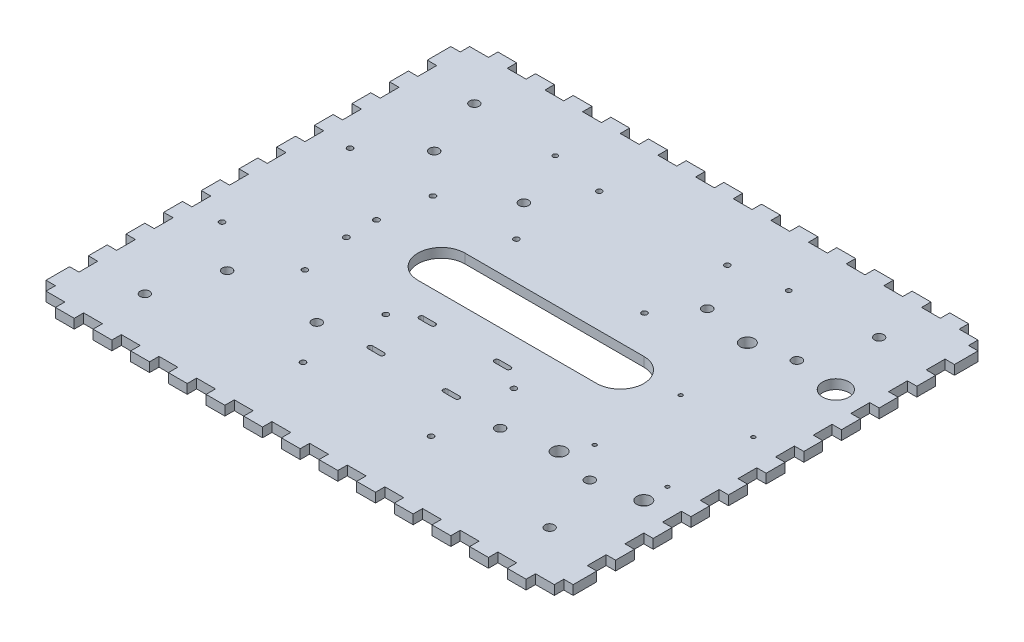
from build123d import *

# Parameters (mm, degrees)
SKETCH1_W               = 355.6
SKETCH1_H               = 298.45
SKETCH1_R               = 1.905
BOSS_EXTRUDE1_DEPTH     = 6.35
SKETCH2_R               = 3.2385
CUT_EXTRUDE1_DEPTH      = 233.209524191
CUT_EXTRUDE3_DEPTH      = 233.209524191
CUT_EXTRUDE4_DEPTH      = 233.209524191
SKETCH8_R               = 4.7625
CUT_EXTRUDE5_DEPTH      = 233.209524191
LPATTERN1_COUNT         = 2
LPATTERN1_PITCH         = 57.15
SKETCH9_R               = 1.27
CUT_EXTRUDE6_DEPTH      = 233.209524191
SKETCH10_R              = 1.8415
CUT_EXTRUDE7_DEPTH      = 233.209524191
SKETCH11_R              = 1.84658
CUT_EXTRUDE8_DEPTH      = 233.209524191
SKETCH13_R              = 8.89
CUT_EXTRUDE9_DEPTH      = 233.209524191
SKETCH16_W              = 25.4
SKETCH16_H              = 12.7
CUT_EXTRUDE19_DEPTH     = 233.209524191
LPATTERN2_COUNT         = 10
LPATTERN2_PITCH         = 25.4
MIRROR4_COPY_1_SKETCH_W = 25.4
MIRROR4_COPY_1_SKETCH_H = 12.7
MIRROR4_COPY_1_DEPTH    = 233.209524191
MIRROR4_COPY_2_SKETCH_W = 25.4
MIRROR4_COPY_2_SKETCH_H = 12.7
MIRROR4_COPY_2_DEPTH    = 233.209524191
MIRROR4_COPY_3_SKETCH_W = 25.4
MIRROR4_COPY_3_SKETCH_H = 12.7
MIRROR4_COPY_3_DEPTH    = 233.209524191
MIRROR4_COPY_4_SKETCH_W = 25.4
MIRROR4_COPY_4_SKETCH_H = 12.7
MIRROR4_COPY_4_DEPTH    = 233.209524191
MIRROR4_COPY_5_SKETCH_W = 25.4
MIRROR4_COPY_5_SKETCH_H = 12.7
MIRROR4_COPY_5_DEPTH    = 233.209524191
MIRROR4_COPY_6_SKETCH_W = 25.4
MIRROR4_COPY_6_SKETCH_H = 12.7
MIRROR4_COPY_6_DEPTH    = 233.209524191
MIRROR4_COPY_7_SKETCH_W = 25.4
MIRROR4_COPY_7_SKETCH_H = 12.7
MIRROR4_COPY_7_DEPTH    = 233.209524191
MIRROR4_COPY_8_SKETCH_W = 25.4
MIRROR4_COPY_8_SKETCH_H = 12.7
MIRROR4_COPY_8_DEPTH    = 233.209524191
MIRROR4_COPY_9_SKETCH_W = 25.4
MIRROR4_COPY_9_SKETCH_H = 12.7
MIRROR4_COPY_9_DEPTH    = 233.209524191
SKETCH17_R              = 3.175
CUT_EXTRUDE20_DEPTH     = 233.209524191
SKETCH18_W              = 25.4
SKETCH18_H              = 25.4
CUT_EXTRUDE21_DEPTH     = 233.209524191
SKETCH15_W              = 12.7
SKETCH15_H              = 25.4
SKETCH15_W_2            = 25.4
CUT_EXTRUDE22_DEPTH     = 233.209524191
SKETCH19_R              = 1.6002
CUT_EXTRUDE23_DEPTH     = 233.209524191


with BuildPart() as part:
    # Sketch1 → Boss-Extrude1 (new body)
    with BuildSketch(Plane(origin=(0, 0, 0), x_dir=(1, 0, 0), z_dir=(0, 1, 0))):
        Rectangle(SKETCH1_W, SKETCH1_H)
        with Locations(Location((-101.6, 10.16, 0), (0, 0, 270))):
            Circle(SKETCH1_R, mode=Mode.SUBTRACT)
        with Locations(Location((-101.6, -10.16, 0), (0, 0, 270))):
            Circle(SKETCH1_R, mode=Mode.SUBTRACT)
    extrude(amount=BOSS_EXTRUDE1_DEPTH)

    # Sketch2 → Cut-Extrude1 (cut, through all)
    with BuildSketch(Plane(origin=(0, 6.35, 0), x_dir=(1, 0, 0), z_dir=(0, 1, 0))):
        with Locations(Location((61.838205, -69.85, 0), (0, 0, 90))):
            Circle(SKETCH2_R)
        with Locations(Location((122.311795, -69.85, 0), (0, 0, 90))):
            Circle(SKETCH2_R)
        with Locations(Location((-122.311795, -69.85, 0), (0, 0, 90))):
            Circle(SKETCH2_R)
        with Locations(Location((-61.838205, -69.85, 0), (0, 0, 90))):
            Circle(SKETCH2_R)
        with Locations(Location((-122.311795, 69.85, 0), (0, 0, 90))):
            Circle(SKETCH2_R)
        with Locations(Location((-61.838205, 69.85, 0), (0, 0, 90))):
            Circle(SKETCH2_R)
        with Locations(Location((61.838205, 69.85, 0), (0, 0, 90))):
            Circle(SKETCH2_R)
        with Locations(Location((122.311795, 69.85, 0), (0, 0, 90))):
            Circle(SKETCH2_R)
    extrude(amount=-CUT_EXTRUDE1_DEPTH, mode=Mode.SUBTRACT)

    # Sketch5 → Cut-Extrude3 (cut, through all)
    with BuildSketch(Plane(origin=(0, 6.35, 0), x_dir=(-1, 0, 0), z_dir=(0, 1, 0))):
        with BuildLine():
            Line((-68.2625, 11.1125), (52.3875, 11.1125))
            ThreePointArc((52.3875, 11.1125), (68.2625, -4.7625), (52.3875, -20.6375))
            Line((52.3875, -20.6375), (-68.2625, -20.6375))
            ThreePointArc((-68.2625, -20.6375), (-84.1375, -4.7625), (-68.2625, 11.1125))
        make_face()
    extrude(amount=-CUT_EXTRUDE3_DEPTH, mode=Mode.SUBTRACT)

    # Sketch7 → Cut-Extrude4 (cut, through all)
    with BuildSketch(Plane(origin=(0, 6.35, 0), x_dir=(1, 0, 0), z_dir=(0, 1, 0))):
        with BuildLine():
            Line((21.43125, -30.1625), (29.36875, -30.1625))
            ThreePointArc((29.36875, -30.1625), (30.95625, -31.75), (29.36875, -33.3375))
            Line((29.36875, -33.3375), (21.43125, -33.3375))
            ThreePointArc((21.43125, -33.3375), (19.84375, -31.75), (21.43125, -30.1625))
        make_face()
        with BuildLine():
            Line((-21.43125, -30.1625), (-29.36875, -30.1625))
            ThreePointArc((-29.36875, -30.1625), (-30.95625, -31.75), (-29.36875, -33.3375))
            Line((-29.36875, -33.3375), (-21.43125, -33.3375))
            ThreePointArc((-21.43125, -33.3375), (-19.84375, -31.75), (-21.43125, -30.1625))
        make_face()
        with BuildLine():
            Line((21.43125, -67.8815), (29.36875, -67.8815))
            ThreePointArc((29.36875, -67.8815), (30.95625, -66.294), (29.36875, -64.7065))
            Line((29.36875, -64.7065), (21.43125, -64.7065))
            ThreePointArc((21.43125, -64.7065), (19.84375, -66.294), (21.43125, -67.8815))
        make_face()
        with BuildLine():
            Line((-21.43125, -67.8815), (-29.36875, -67.8815))
            ThreePointArc((-29.36875, -67.8815), (-30.95625, -66.294), (-29.36875, -64.7065))
            Line((-29.36875, -64.7065), (-21.43125, -64.7065))
            ThreePointArc((-21.43125, -64.7065), (-19.84375, -66.294), (-21.43125, -67.8815))
        make_face()
    extrude(amount=-CUT_EXTRUDE4_DEPTH, mode=Mode.SUBTRACT)

    # Sketch8 → Cut-Extrude5 (cut, through all)
    with BuildSketch(Plane(origin=(0, 6.35, 0), x_dir=(1, 0, 0), z_dir=(0, 1, 0))):
        with Locations(Location((152.4, 63.5, 0), (0, 0, 270))):
            Circle(SKETCH8_R)
        with Locations(Location((152.4, -63.5, 0), (0, 0, 90))):
            Circle(SKETCH8_R)
    cut_extrude5 = extrude(amount=-CUT_EXTRUDE5_DEPTH, mode=Mode.SUBTRACT)

    # LPattern1: Cut-Extrude5 ×2
    with Locations(*[(-i * LPATTERN1_PITCH, 0, 0) for i in range(1, LPATTERN1_COUNT)]):
        add(cut_extrude5, mode=Mode.SUBTRACT)

    # Sketch9 → Cut-Extrude6 (cut, through all)
    with BuildSketch(Plane(origin=(0, 6.35, 0), x_dir=(1, 0, 0), z_dir=(0, 1, 0))):
        with Locations(Location((103.400098, 10.374884, 0), (0, 0, 270))):
            Circle(SKETCH9_R)
        with Locations(Location((152.4, 10.374884, 0), (0, 0, 270))):
            Circle(SKETCH9_R)
        with Locations(Location((103.400098, -47.625, 0), (0, 0, 270))):
            Circle(SKETCH9_R)
        with Locations(Location((152.4, -47.625, 0), (0, 0, 270))):
            Circle(SKETCH9_R)
    extrude(amount=-CUT_EXTRUDE6_DEPTH, mode=Mode.SUBTRACT)

    # Sketch10 → Cut-Extrude7 (cut, through all)
    with BuildSketch(Plane(origin=(0, 6.35, 0), x_dir=(1, 0, 0), z_dir=(0, 1, 0))):
        with Locations(Location((-43.18, -41.91, 0), (0, 0, 270))):
            Circle(SKETCH10_R)
        with Locations(Location((43.18, -41.91, 0), (0, 0, 90))):
            Circle(SKETCH10_R)
        with Locations(Location((43.18, -97.79, 0), (0, 0, 270))):
            Circle(SKETCH10_R)
        with Locations(Location((-43.18, -97.79, 0), (0, 0, 90))):
            Circle(SKETCH10_R)
    cut_extrude7 = extrude(amount=-CUT_EXTRUDE7_DEPTH, mode=Mode.SUBTRACT)

    # Mirror2: Cut-Extrude7 across plane
    add(cut_extrude7.mirror(Plane.XY.offset(-2.116666582)), mode=Mode.SUBTRACT)

    # Sketch11 → Cut-Extrude8 (cut, through all)
    with BuildSketch(Plane(origin=(0, 6.35, 0), x_dir=(1, 0, 0), z_dir=(0, 1, 0))):
        with Locations(Location((-152.4, 43.18, 0), (0, 0, 270))):
            Circle(SKETCH11_R)
        with Locations(Location((-96.52, 43.18, 0), (0, 0, 90))):
            Circle(SKETCH11_R)
        with Locations(Location((-96.52, -43.18, 0), (0, 0, 270))):
            Circle(SKETCH11_R)
        with Locations(Location((-152.4, -43.18, 0), (0, 0, 90))):
            Circle(SKETCH11_R)
    extrude(amount=-CUT_EXTRUDE8_DEPTH, mode=Mode.SUBTRACT)

    # Sketch13 → Cut-Extrude9 (cut, through all)
    with BuildSketch(Plane(origin=(0, 6.35, 0), x_dir=(1, 0, 0), z_dir=(0, 1, 0))):
        with Locations(Location((152.4, 66.04, 0), (0, 0, 270))):
            Circle(SKETCH13_R)
    extrude(amount=-CUT_EXTRUDE9_DEPTH, mode=Mode.SUBTRACT)

    # Sketch16 → Cut-Extrude19 (cut, symmetric)
    with BuildSketch(Plane(origin=(0, 6.35, 0), x_dir=(1, 0, 0), z_dir=(0, 1, 0))):
        with Locations((184.15, 114.3)):
            Rectangle(SKETCH16_W, SKETCH16_H)
    cut_extrude19 = extrude(amount=CUT_EXTRUDE19_DEPTH, both=True, mode=Mode.SUBTRACT)

    # LPattern2: Cut-Extrude19 ×10
    with Locations(*[(0, 0, i * LPATTERN2_PITCH) for i in range(1, LPATTERN2_COUNT)]):
        add(cut_extrude19, mode=Mode.SUBTRACT)

    # Mirror4: Cut-Extrude19 across plane
    add(cut_extrude19.mirror(Plane(origin=(0, 0, 0), x_dir=(0, 0, 1), z_dir=(1, 0, 0))), mode=Mode.SUBTRACT)

    # Mirror4 copy 1 sketch → Mirror4 copy 1 (cut, symmetric)
    with BuildSketch(Plane(origin=(0, 6.35, 25.4), x_dir=(-1, 0, 0), z_dir=(0, 1, 0))):
        with Locations((184.15, -114.3)):
            Rectangle(MIRROR4_COPY_1_SKETCH_W, MIRROR4_COPY_1_SKETCH_H)
    extrude(amount=MIRROR4_COPY_1_DEPTH, both=True, mode=Mode.SUBTRACT)

    # Mirror4 copy 2 sketch → Mirror4 copy 2 (cut, symmetric)
    with BuildSketch(Plane(origin=(0, 6.35, 50.8), x_dir=(-1, 0, 0), z_dir=(0, 1, 0))):
        with Locations((184.15, -114.3)):
            Rectangle(MIRROR4_COPY_2_SKETCH_W, MIRROR4_COPY_2_SKETCH_H)
    extrude(amount=MIRROR4_COPY_2_DEPTH, both=True, mode=Mode.SUBTRACT)

    # Mirror4 copy 3 sketch → Mirror4 copy 3 (cut, symmetric)
    with BuildSketch(Plane(origin=(0, 6.35, 76.2), x_dir=(-1, 0, 0), z_dir=(0, 1, 0))):
        with Locations((184.15, -114.3)):
            Rectangle(MIRROR4_COPY_3_SKETCH_W, MIRROR4_COPY_3_SKETCH_H)
    extrude(amount=MIRROR4_COPY_3_DEPTH, both=True, mode=Mode.SUBTRACT)

    # Mirror4 copy 4 sketch → Mirror4 copy 4 (cut, symmetric)
    with BuildSketch(Plane(origin=(0, 6.35, 101.6), x_dir=(-1, 0, 0), z_dir=(0, 1, 0))):
        with Locations((184.15, -114.3)):
            Rectangle(MIRROR4_COPY_4_SKETCH_W, MIRROR4_COPY_4_SKETCH_H)
    extrude(amount=MIRROR4_COPY_4_DEPTH, both=True, mode=Mode.SUBTRACT)

    # Mirror4 copy 5 sketch → Mirror4 copy 5 (cut, symmetric)
    with BuildSketch(Plane(origin=(0, 6.35, 127), x_dir=(-1, 0, 0), z_dir=(0, 1, 0))):
        with Locations((184.15, -114.3)):
            Rectangle(MIRROR4_COPY_5_SKETCH_W, MIRROR4_COPY_5_SKETCH_H)
    extrude(amount=MIRROR4_COPY_5_DEPTH, both=True, mode=Mode.SUBTRACT)

    # Mirror4 copy 6 sketch → Mirror4 copy 6 (cut, symmetric)
    with BuildSketch(Plane(origin=(0, 6.35, 152.4), x_dir=(-1, 0, 0), z_dir=(0, 1, 0))):
        with Locations((184.15, -114.3)):
            Rectangle(MIRROR4_COPY_6_SKETCH_W, MIRROR4_COPY_6_SKETCH_H)
    extrude(amount=MIRROR4_COPY_6_DEPTH, both=True, mode=Mode.SUBTRACT)

    # Mirror4 copy 7 sketch → Mirror4 copy 7 (cut, symmetric)
    with BuildSketch(Plane(origin=(0, 6.35, 177.8), x_dir=(-1, 0, 0), z_dir=(0, 1, 0))):
        with Locations((184.15, -114.3)):
            Rectangle(MIRROR4_COPY_7_SKETCH_W, MIRROR4_COPY_7_SKETCH_H)
    extrude(amount=MIRROR4_COPY_7_DEPTH, both=True, mode=Mode.SUBTRACT)

    # Mirror4 copy 8 sketch → Mirror4 copy 8 (cut, symmetric)
    with BuildSketch(Plane(origin=(0, 6.35, 203.2), x_dir=(-1, 0, 0), z_dir=(0, 1, 0))):
        with Locations((184.15, -114.3)):
            Rectangle(MIRROR4_COPY_8_SKETCH_W, MIRROR4_COPY_8_SKETCH_H)
    extrude(amount=MIRROR4_COPY_8_DEPTH, both=True, mode=Mode.SUBTRACT)

    # Mirror4 copy 9 sketch → Mirror4 copy 9 (cut, symmetric)
    with BuildSketch(Plane(origin=(0, 6.35, 228.6), x_dir=(-1, 0, 0), z_dir=(0, 1, 0))):
        with Locations((184.15, -114.3)):
            Rectangle(MIRROR4_COPY_9_SKETCH_W, MIRROR4_COPY_9_SKETCH_H)
    extrude(amount=MIRROR4_COPY_9_DEPTH, both=True, mode=Mode.SUBTRACT)

    # Sketch17 → Cut-Extrude20 (cut, through all)
    with BuildSketch(Plane(origin=(0, 6.35, 0), x_dir=(1, 0, 0), z_dir=(0, 1, 0))):
        with Locations(Location((-136.525, 111.125, 0), (0, 0, 270))):
            Circle(SKETCH17_R)
        with Locations(Location((136.525, 111.125, 0), (0, 0, 270))):
            Circle(SKETCH17_R)
        with Locations(Location((136.525, -111.125, 0), (0, 0, 270))):
            Circle(SKETCH17_R)
        with Locations(Location((-136.525, -111.125, 0), (0, 0, 270))):
            Circle(SKETCH17_R)
    extrude(amount=-CUT_EXTRUDE20_DEPTH, mode=Mode.SUBTRACT)

    # Sketch18 → Cut-Extrude21 (cut, through all)
    with BuildSketch(Plane(origin=(0, 6.35, 0), x_dir=(1, 0, 0), z_dir=(0, 1, 0))):
        with Locations((184.15, 149.225)):
            Rectangle(SKETCH18_W, SKETCH18_H)
        with Locations((-184.15, 149.225)):
            Rectangle(SKETCH18_W, SKETCH18_H)
        with Locations((184.15, -149.225)):
            Rectangle(SKETCH18_W, SKETCH18_H)
        with Locations((-184.15, -149.225)):
            Rectangle(SKETCH18_W, SKETCH18_H)
    extrude(amount=-CUT_EXTRUDE21_DEPTH, mode=Mode.SUBTRACT)

    # Sketch15 → Cut-Extrude22 (cut, through all)
    with BuildSketch(Plane(origin=(0, 6.35, 0), x_dir=(1, 0, 0), z_dir=(0, 1, 0))):
        with Locations((139.7, 155.575)):
            Rectangle(SKETCH15_W, SKETCH15_H)
        with Locations((114.3, 155.575)):
            Rectangle(SKETCH15_W, SKETCH15_H)
        with Locations((88.9, 155.575)):
            Rectangle(SKETCH15_W, SKETCH15_H)
        with Locations((63.5, 155.575)):
            Rectangle(SKETCH15_W, SKETCH15_H)
        with Locations((38.1, 155.575)):
            Rectangle(SKETCH15_W, SKETCH15_H)
        with Locations((12.7, 155.575)):
            Rectangle(SKETCH15_W, SKETCH15_H)
        with Locations((-12.7, 155.575)):
            Rectangle(SKETCH15_W, SKETCH15_H)
        with Locations((-38.1, 155.575)):
            Rectangle(SKETCH15_W, SKETCH15_H)
        with Locations((-63.5, 155.575)):
            Rectangle(SKETCH15_W, SKETCH15_H)
        with Locations((-88.9, 155.575)):
            Rectangle(SKETCH15_W, SKETCH15_H)
        with Locations((-114.3, 155.575)):
            Rectangle(SKETCH15_W, SKETCH15_H)
        with Locations((-139.7, 155.575)):
            Rectangle(SKETCH15_W, SKETCH15_H)
        with Locations((-171.45, 155.575)):
            Rectangle(SKETCH15_W_2, SKETCH15_H)
        with Locations((171.45, 155.575)):
            Rectangle(SKETCH15_W_2, SKETCH15_H)
    cut_extrude22 = extrude(amount=-CUT_EXTRUDE22_DEPTH, mode=Mode.SUBTRACT)

    # Mirror5: Cut-Extrude22 across plane
    add(cut_extrude22.mirror(Plane.XY), mode=Mode.SUBTRACT)

    # Sketch19 → Cut-Extrude23 (cut, through all)
    with BuildSketch(Plane(origin=(0, 6.35, 0), x_dir=(1, 0, 0), z_dir=(0, 1, 0))):
        with Locations(Location((-78.74, 107.95, 0), (0, 0, 270))):
            Circle(SKETCH19_R)
        with Locations(Location((78.74, 107.95, 0), (0, 0, 270))):
            Circle(SKETCH19_R)
    extrude(amount=-CUT_EXTRUDE23_DEPTH, mode=Mode.SUBTRACT)


solid = part.part
